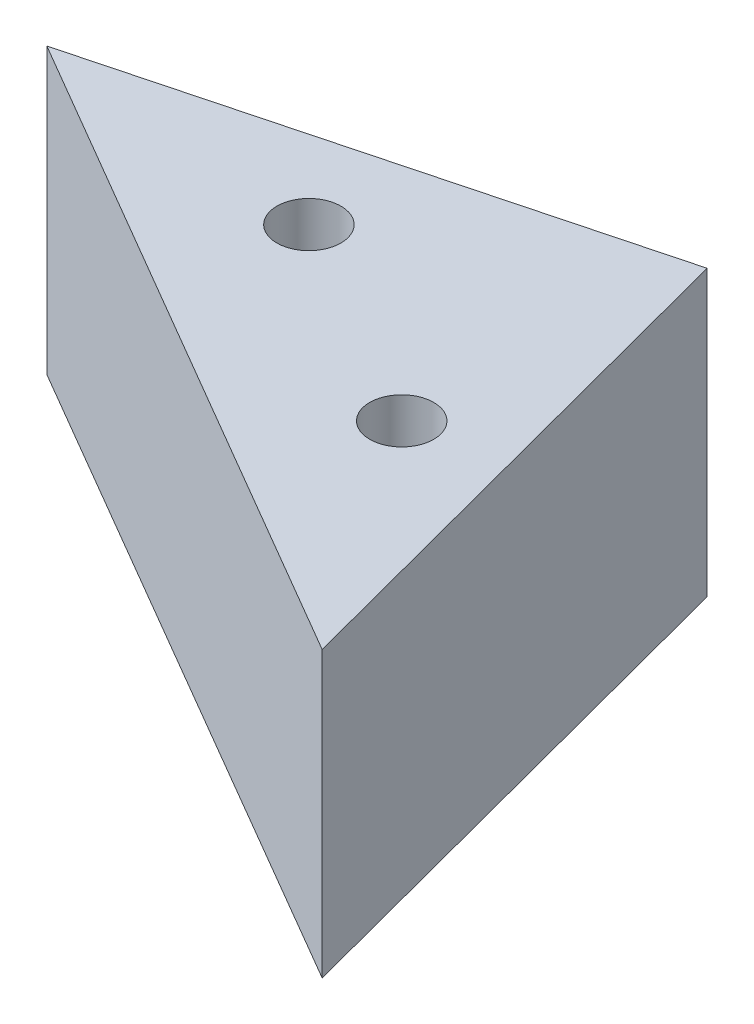
from build123d import *

# Parameters (mm, degrees)
BOSS_EXTRUDE1_DEPTH = 20
SKETCH8_R           = 2.25
CUT_EXTRUDE3_DEPTH  = 5


with BuildPart() as part:
    # Sketch1 → Boss-Extrude1 (new body)
    with BuildSketch(Plane(origin=(0, 0, 0), x_dir=(1, 0, 0), z_dir=(0, 1, 0))):
        Polygon((0, 0), (46.42630295, -27.066325838), (36.746372501, 9.680088225), align=None)
    extrude(amount=-BOSS_EXTRUDE1_DEPTH)

    # Sketch8 → Cut-Extrude3 (cut)
    with BuildSketch(Plane(origin=(0, 0, 0), x_dir=(1, 0, 0), z_dir=(0, 1, 0))):
        with Locations(Location((20.085479714, -1.659955888, 0), (0, 0, 270))):
            Circle(SKETCH8_R)
        with Locations(Location((35.300766899, -10.348896383, 0), (0, 0, 270))):
            Circle(SKETCH8_R)
    extrude(amount=-CUT_EXTRUDE3_DEPTH, mode=Mode.SUBTRACT)


solid = part.part
